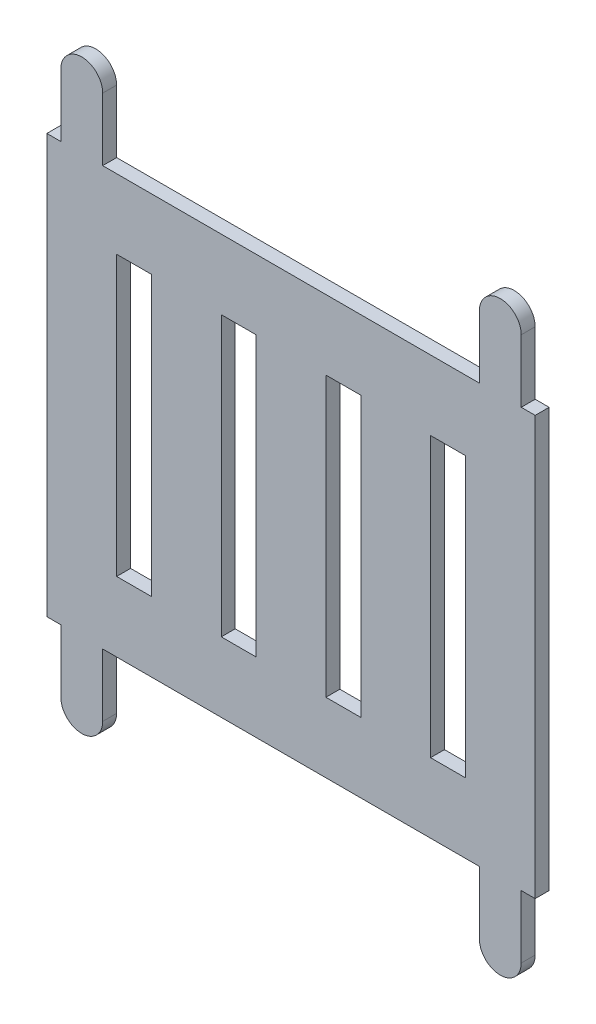
from build123d import *

# Parameters (mm, degrees)
SKETCH_1_W      = 5
SKETCH_1_H      = 40
EXTRUDE_1_DEPTH = 1


with BuildPart() as part:
    # 草图1 → 凸台-拉伸1 (new, symmetric)
    with BuildSketch(Plane.XY):
        with BuildLine():
            Line((2, 0), (2, -9))
            ThreePointArc((2, -9), (5, -12), (8, -9))
            Line((8, -9), (8, 0))
            Line((8, 0), (62, 0))
            Line((62, 0), (62, -9))
            ThreePointArc((62, -9), (65, -12), (68, -9))
            Line((68, -9), (68, 0))
            Line((68, 0), (70, 0))
            Line((70, 0), (70, 60))
            Line((70, 60), (68, 60))
            Line((68, 60), (68, 69))
            ThreePointArc((68, 69), (65, 72), (62, 69))
            Line((62, 69), (62, 60))
            Line((62, 60), (8, 60))
            Line((8, 60), (8, 69))
            ThreePointArc((8, 69), (5, 72), (2, 69))
            Line((2, 69), (2, 60))
            Line((2, 60), (0, 60))
            Line((0, 60), (0, 0))
            Line((0, 0), (2, 0))
        make_face()
        with Locations((12.5, 30)):
            Rectangle(SKETCH_1_W, SKETCH_1_H, mode=Mode.SUBTRACT)
        with Locations((27.5, 30)):
            Rectangle(SKETCH_1_W, SKETCH_1_H, mode=Mode.SUBTRACT)
        with Locations((42.5, 30)):
            Rectangle(SKETCH_1_W, SKETCH_1_H, mode=Mode.SUBTRACT)
        with Locations((57.5, 30)):
            Rectangle(SKETCH_1_W, SKETCH_1_H, mode=Mode.SUBTRACT)
    extrude(amount=EXTRUDE_1_DEPTH, both=True)


solid = part.part
